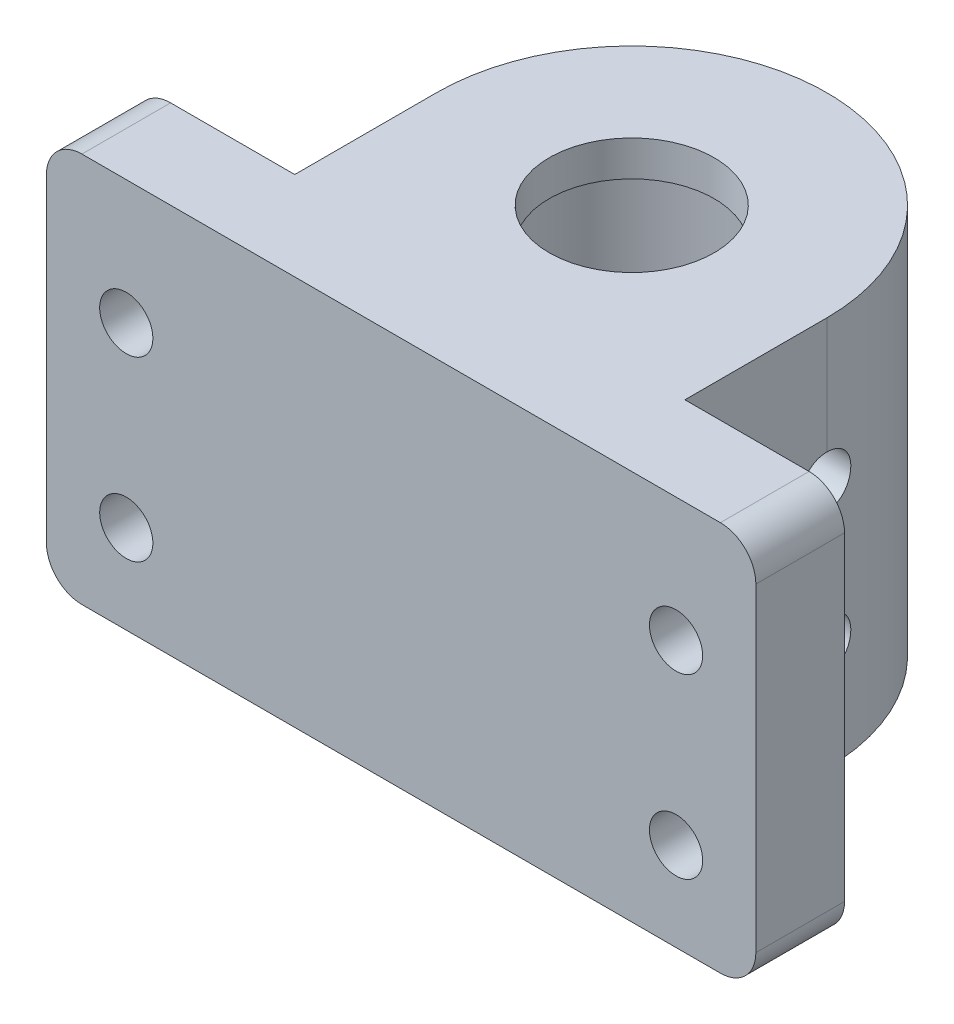
from build123d import *

# Parameters (mm, degrees)
SKETCH_1_R               = 6.65
EXTRUDE_1_DEPTH          = 20
SKETCH_2_R               = 1.5
CUT_EXTRUDE_1_DEPTH      = 35.073450075
SKETCH_3_R               = 1.45
CUT_EXTRUDE_2_DEPTH      = 10
PATTERN_CIRCULAR_1_COUNT = 2
PATTERN_CIRCULAR_1_ANGLE = 90
F_1_THE_OTHER_WAY_COUNT  = 2
F_1_THE_OTHER_WAY_ANGLE  = 90
SKETCH_4_R               = 4.65
EXTRUDE_2_DEPTH          = 2
FILLET_1_R               = 2


with BuildPart() as part:
    # 草图1 → 凸台-拉伸1 (new body)
    with BuildSketch(Plane(origin=(0, 0, 0), x_dir=(1, 0, 0), z_dir=(0, 1, 0))):
        with BuildLine():
            Line((-11, 0), (-11, -8))
            Line((-11, -8), (-20, -8))
            Line((-20, -8), (-20, -13))
            Line((-20, -13), (20, -13))
            Line((20, -13), (20, -8))
            Line((20, -8), (11, -8))
            Line((11, -8), (11, 0))
            ThreePointArc((11, 0), (0, 11), (-11, 0))
        make_face()
        with Locations(Location((0, 0, 0), (0, 0, 270))):
            Circle(SKETCH_1_R, mode=Mode.SUBTRACT)
    extrude(amount=EXTRUDE_1_DEPTH)

    # 草图2 → 切除-拉伸1 (cut, through all)
    with BuildSketch(Plane(origin=(0, 0, 8), x_dir=(-1, 0, 0), z_dir=(0, 0, -1))):
        with Locations((15.5, 5)):
            Circle(SKETCH_2_R)
        with Locations(Location((15.5, 15, 0), (0, 0, 180))):
            Circle(SKETCH_2_R)
        with Locations((-15.5, 15)):
            Circle(SKETCH_2_R)
        with Locations(Location((-15.5, 5, 0), (0, 0, 180))):
            Circle(SKETCH_2_R)
    extrude(amount=-CUT_EXTRUDE_1_DEPTH, mode=Mode.SUBTRACT)

    # 草图3 → 切除-拉伸2 (cut)
    with BuildSketch(Plane(origin=(0, 0, -11), x_dir=(-1, 0, 0), z_dir=(0, 0, -1))):
        with Locations((0, 6)):
            Circle(SKETCH_3_R)
        with Locations((0, 14)):
            Circle(SKETCH_3_R)
    cut_extrude_2 = extrude(amount=-CUT_EXTRUDE_2_DEPTH, mode=Mode.SUBTRACT)

    # 阵列(圆周)1: 切除-拉伸2 ×2 about axis
    pattern_circular_1_axis = Axis((0, 20, 0), (0, -1, 0))
    for i in range(1, PATTERN_CIRCULAR_1_COUNT):
        add(cut_extrude_2.rotate(pattern_circular_1_axis, i * PATTERN_CIRCULAR_1_ANGLE / (PATTERN_CIRCULAR_1_COUNT - 1)), mode=Mode.SUBTRACT)

    # 1 the other way: 切除-拉伸2 ×2 about axis
    f_1_the_other_way_axis = Axis((0, 20, 0), (0, 1, 0))
    for i in range(1, F_1_THE_OTHER_WAY_COUNT):
        add(cut_extrude_2.rotate(f_1_the_other_way_axis, i * F_1_THE_OTHER_WAY_ANGLE / (F_1_THE_OTHER_WAY_COUNT - 1)), mode=Mode.SUBTRACT)

    # 草图4 → 凸台-拉伸2 (add)
    with BuildSketch(Plane(origin=(0, 20, 0), x_dir=(1, 0, 0), z_dir=(0, 1, 0))):
        with BuildLine():
            Line((20, -8), (11, -8))
            Line((11, -8), (11, 0))
            ThreePointArc((11, 0), (0, 11), (-11, 0))
            Line((-11, 0), (-11, -8))
            Line((-11, -8), (-20, -8))
            Line((-20, -8), (-20, -13))
            Line((-20, -13), (20, -13))
            Line((20, -13), (20, -8))
        make_face()
        with Locations(Location((0, 0, 0), (0, 0, 270))):
            Circle(SKETCH_4_R, mode=Mode.SUBTRACT)
    extrude(amount=EXTRUDE_2_DEPTH)

    # 圆角1
    fillet_1_edges = [part.edges().sort_by_distance(p)[0] for p in [
        (20, 0, 10.5),
        (-20, 0, 10.5),
        (20, 22, 10.5),
        (-20, 22, 10.5),
    ]]
    fillet(fillet_1_edges, radius=FILLET_1_R)


solid = part.part
